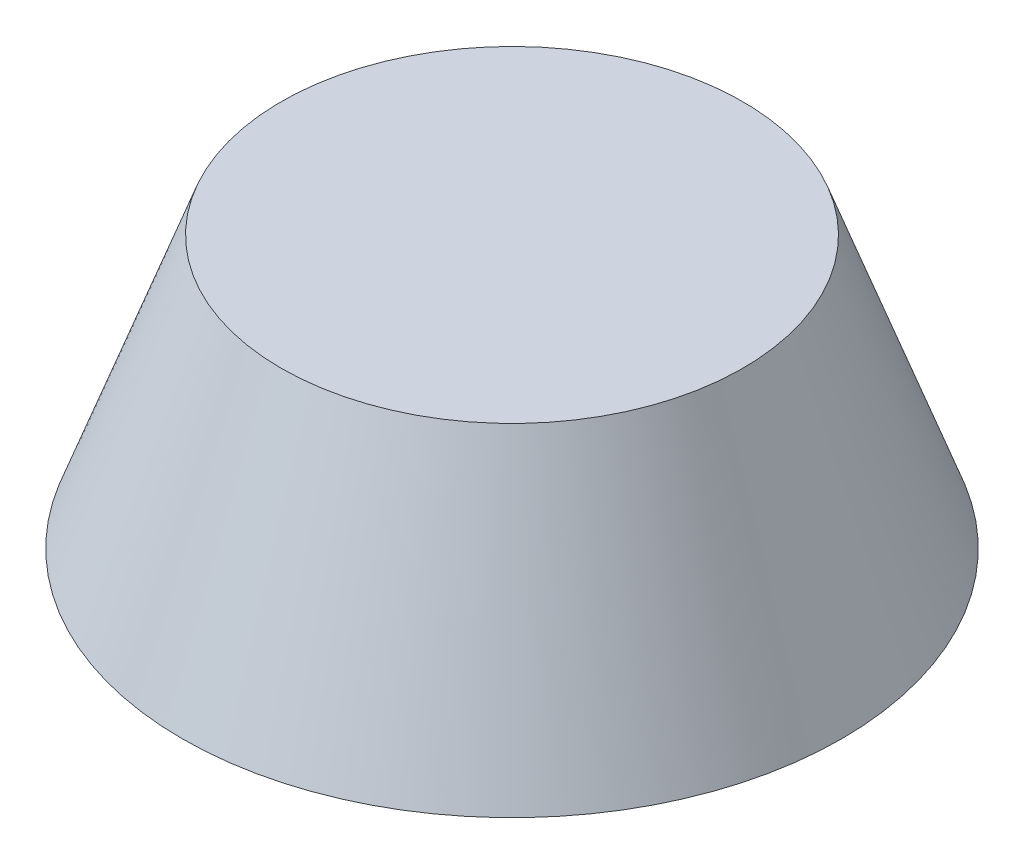
from build123d import *

# Parameters (mm, degrees)
SKETCH_1_R      = 17
EXTRUDE_1_DEPTH = 14
EXTRUDE_1_TAPER = 20


with BuildPart() as part:
    # 草图1 → 凸台-拉伸1 (new body)
    with BuildSketch(Plane(origin=(0, 0, 0), x_dir=(1, 0, 0), z_dir=(0, 1, 0))):
        Circle(SKETCH_1_R)
    extrude(amount=EXTRUDE_1_DEPTH, taper=EXTRUDE_1_TAPER)


solid = part.part
